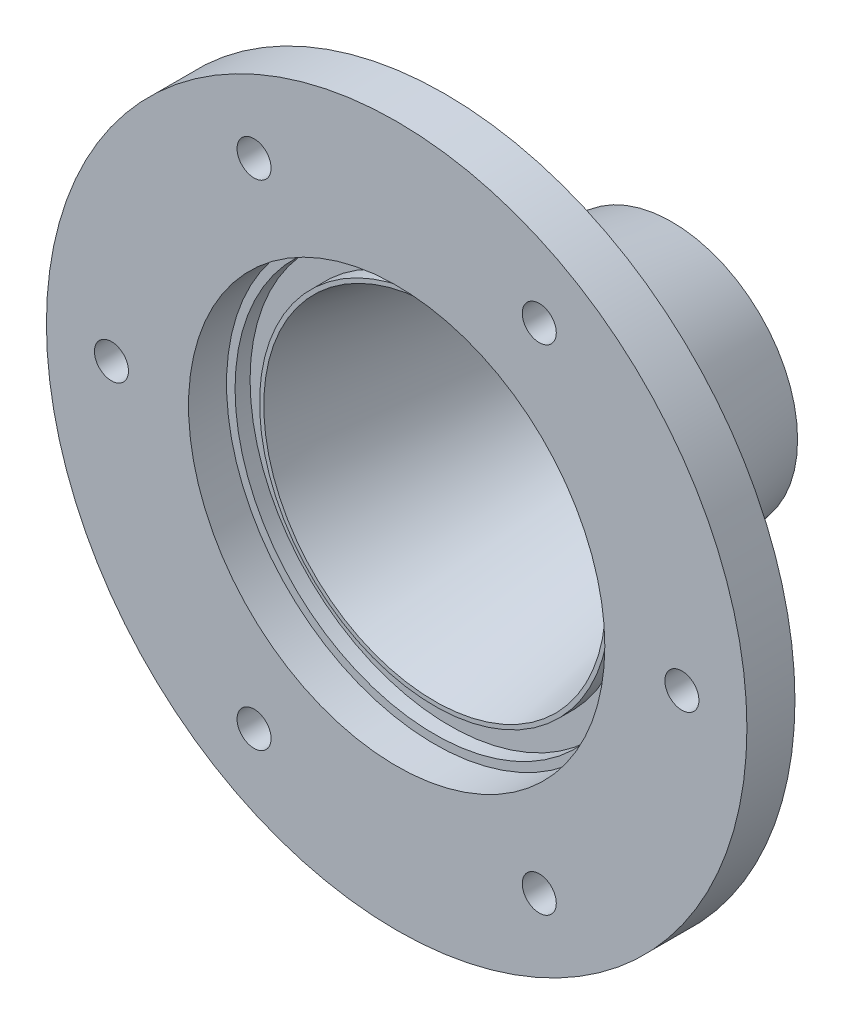
from build123d import *

# Parameters (mm, degrees)
SKETCH1_R            = 35
BOSS_EXTRUDE1_DEPTH  = 6.8
M3_CLEARANCE_HOLE1_D = 3.4
CIRPATTERN1_COUNT    = 6
SKETCH5_R            = 20.8
CUT_EXTRUDE1_DEPTH   = 3.8
SKETCH6_R            = 19.95
SKETCH6_R_2          = 17.5
CUT_EXTRUDE2_DEPTH   = 1.5
SKETCH7_R            = 42.836472813
SKETCH7_R_2          = 24.95
CUT_EXTRUDE3_DEPTH   = 2
SKETCH11_R           = 16.635
BOSS_EXTRUDE5_DEPTH  = 20.7
BOSS_EXTRUDE5_DRAFT  = -11.13
SKETCH12_R           = 17.08
CUT_EXTRUDE5_DEPTH   = 28
CUT_EXTRUDE5_DRAFT   = -11.13


with BuildPart() as part:
    # Sketch1 → Boss-Extrude1 (new body)
    with BuildSketch(Plane.XY):
        Circle(SKETCH1_R)
    extrude(amount=-BOSS_EXTRUDE1_DEPTH)

    # M3 Clearance Hole1 (through all)
    with Locations(Plane.XY):
        with Locations((-28.5, 0)):
            m3_clearance_hole1 = Hole(M3_CLEARANCE_HOLE1_D / 2)

    # CirPattern1: M3 Clearance Hole1 ×6 about axis
    cirpattern1_axis = Axis((0, 0, 0), (0, 0, 1))
    for i in range(1, CIRPATTERN1_COUNT):
        add(m3_clearance_hole1.rotate(cirpattern1_axis, i * 360 / CIRPATTERN1_COUNT), mode=Mode.SUBTRACT)

    # Sketch5 → Cut-Extrude1 (cut)
    with BuildSketch(Plane.XY):
        Circle(SKETCH5_R)
    extrude(amount=-CUT_EXTRUDE1_DEPTH, mode=Mode.SUBTRACT)

    # Sketch6 → Cut-Extrude2 (cut)
    with BuildSketch(Plane.XY.offset(-3.8)):
        Circle(SKETCH6_R)
        Circle(SKETCH6_R_2, mode=Mode.SUBTRACT)
    extrude(amount=-CUT_EXTRUDE2_DEPTH, mode=Mode.SUBTRACT)

    # Sketch7 → Cut-Extrude3 (cut)
    with BuildSketch(Plane(origin=(0, 0, -6.8), x_dir=(-1, 0, 0), z_dir=(0, 0, -1))):
        Circle(SKETCH7_R)
        Circle(SKETCH7_R_2, mode=Mode.SUBTRACT)
    extrude(amount=-CUT_EXTRUDE3_DEPTH, mode=Mode.SUBTRACT)


with BuildPart() as boss_extrude5_tool:
    # Sketch11 → Boss-Extrude5 (with draft: the straight prism first)
    with BuildSketch(Plane.XY.offset(-6.8)):
        Circle(SKETCH11_R)
    extrude(amount=-BOSS_EXTRUDE5_DEPTH)
    # Boss-Extrude5: the draft: its side faces are tilted about the plane it starts from
    boss_extrude5_sides = [boss_extrude5_tool.faces().sort_by_distance(p)[0] for p in [
        (-16.635, 0, -17.15),
    ]]
    draft(boss_extrude5_sides, Plane.XY.offset(-6.8), BOSS_EXTRUDE5_DRAFT)


with BuildPart() as part_1:
    add(part.part)

    # Boss-Extrude5: add boss_extrude5_tool
    add(boss_extrude5_tool.part)


with BuildPart() as cut_extrude5_tool:
    # Sketch12 → Cut-Extrude5 (with draft: the straight prism first)
    with BuildSketch(Plane.XY.offset(-3.8)):
        Circle(SKETCH12_R)
    extrude(amount=-CUT_EXTRUDE5_DEPTH)
    # Cut-Extrude5: the draft: its side faces are tilted about the plane it starts from
    cut_extrude5_sides = [cut_extrude5_tool.faces().sort_by_distance(p)[0] for p in [
        (-17.08, 0, -17.8),
    ]]
    draft(cut_extrude5_sides, Plane.XY.offset(-3.8), CUT_EXTRUDE5_DRAFT)


with BuildPart() as part_2:
    add(part_1.part)

    # Cut-Extrude5: cut by cut_extrude5_tool
    add(cut_extrude5_tool.part, mode=Mode.SUBTRACT)


solid = part_2.part
